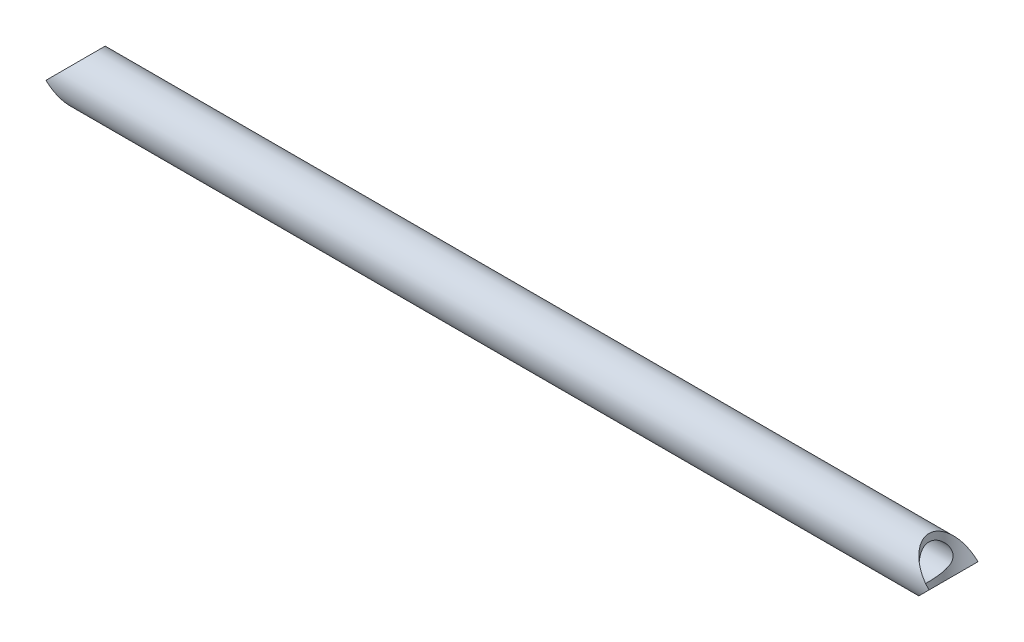
from build123d import *

# Parameters (mm, degrees)
SKETCH2_R               = 50
SKETCH2_R_2             = 35
CUT_EXTRUDE1_DEPTH      = 903.773504263
CUT_EXTRUDE1_DEPTH_BACK = 903.773504263
SKETCH3_R               = 50


with BuildPart() as part:
    # Sweep1: sweep along a path in Sketch1
    with BuildLine(Plane(origin=(0, 0, 0), x_dir=(1, 0, 0), z_dir=(0, 1, 0))) as sweep1_path:
        Line((-900, 0), (900, 0))
    # Sketch2 → Sweep1 (sweep)
    with BuildSketch(Plane(origin=(0, 0, 0), x_dir=(0, 0, -1), z_dir=(1, 0, 0))):
        Circle(SKETCH2_R)
        Circle(SKETCH2_R_2, mode=Mode.SUBTRACT)
    sweep(path=sweep1_path.line)

    # Sketch3 → Cut-Extrude1 (cut, two sides: drawn at the far end of the back side and taken through both)
    with BuildSketch(Plane(origin=(0, 0, 0), x_dir=(1, 0, 0), z_dir=(0, 1, 0)).offset(-CUT_EXTRUDE1_DEPTH_BACK)):
        with Locations((900, 0)):
            Circle(SKETCH3_R)
        with Locations((-900, 0)):
            Circle(SKETCH3_R)
    extrude(amount=CUT_EXTRUDE1_DEPTH + CUT_EXTRUDE1_DEPTH_BACK, mode=Mode.SUBTRACT)


solid = part.part
